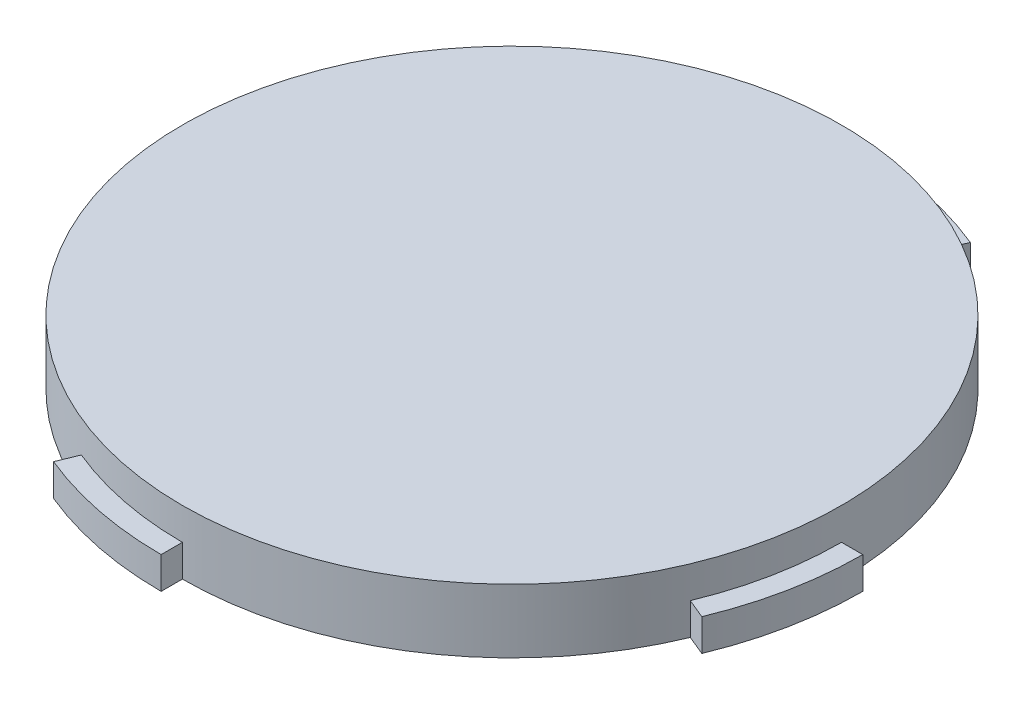
from build123d import *
from build123d.topology import SkipClean

# Parameters (mm, degrees)
SKETCH8_R            = 31
BOSS_EXTRUDE9_DEPTH  = 3
SKETCH11_R           = 31
BOSS_EXTRUDE10_DEPTH = 3


with BuildPart() as part:
    # Sketch8 → Boss-Extrude9 (new body)
    with BuildSketch(Plane(origin=(0, 0, 0), x_dir=(1, 0, 0), z_dir=(0, 1, 0))):
        Circle(SKETCH8_R)
        with BuildLine():
            ThreePointArc((0, -31), (-6.047799982, -30.404343693), (-11.863186403, -28.640265508))
            Line((-11.863186403, -28.640265508), (-12.628553268, -30.488024573))
            ThreePointArc((-12.628553268, -30.488024573), (-6.437980627, -32.365914253), (0, -33))
            Line((0, -33), (0, -31))
        make_face()
        with BuildLine():
            ThreePointArc((-31, 0), (-30.404343693, 6.047799982), (-28.640265508, 11.863186403))
            Line((-28.640265508, 11.863186403), (-30.488024573, 12.628553268))
            ThreePointArc((-30.488024573, 12.628553268), (-32.365914253, 6.437980627), (-33, 0))
            Line((-33, 0), (-31, 0))
        make_face()
        with BuildLine():
            ThreePointArc((12.628553268, 30.488024573), (6.437980627, 32.365914253), (0, 33))
            Line((0, 33), (0, 31))
            ThreePointArc((0, 31), (6.047799982, 30.404343693), (11.863186403, 28.640265508))
            Line((11.863186403, 28.640265508), (12.628553268, 30.488024573))
        make_face()
        with BuildLine():
            Line((33, 0), (31, 0))
            ThreePointArc((31, 0), (30.404343693, -6.047799982), (28.640265508, -11.863186403))
            Line((28.640265508, -11.863186403), (30.488024573, -12.628553268))
            ThreePointArc((30.488024573, -12.628553268), (32.365914253, -6.437980627), (33, 0))
        make_face()
    extrude(amount=BOSS_EXTRUDE9_DEPTH)

    # Sketch11 → Boss-Extrude10 (add)
    with SkipClean():  # the faces are left unmerged after this step: merging them gives an invalid solid
        with BuildSketch(Plane(origin=(0, 3, 0), x_dir=(1, 0, 0), z_dir=(0, 1, 0))):
            with Locations(Location((0, 0, 0), (0, 0, 270))):
                Circle(SKETCH11_R)
        extrude(amount=BOSS_EXTRUDE10_DEPTH)


solid = part.part
